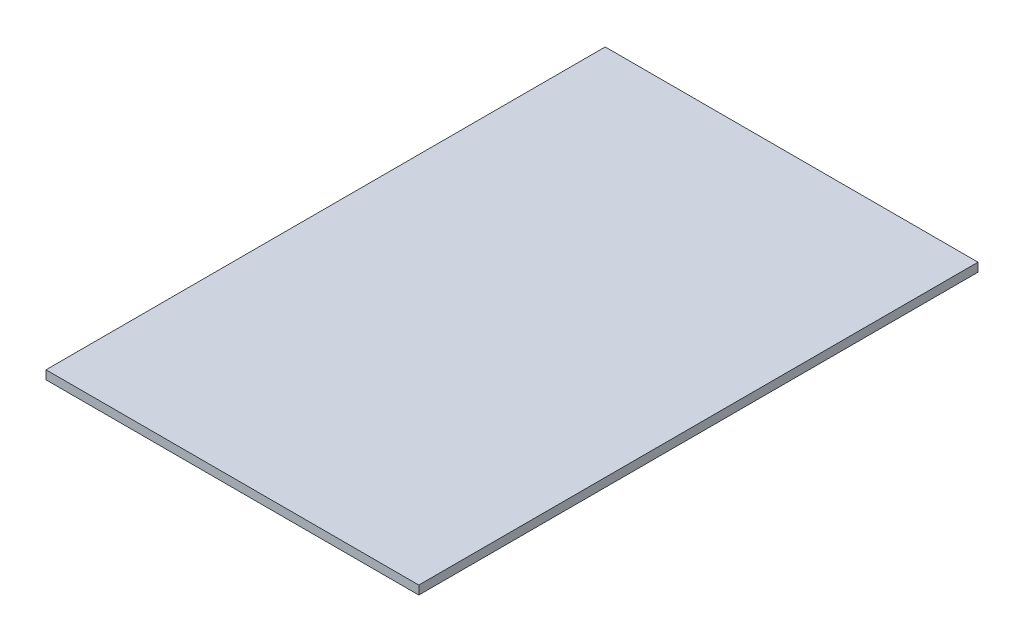
from build123d import *

# Parameters (mm, degrees)
SKETCH1_W           = 600
SKETCH1_H           = 900
BOSS_EXTRUDE1_DEPTH = 14


with BuildPart() as part:
    # Sketch1 → Boss-Extrude1 (new body)
    with BuildSketch(Plane(origin=(0, 0, 0), x_dir=(1, 0, 0), z_dir=(0, 1, 0))):
        with Locations((300, 450)):
            Rectangle(SKETCH1_W, SKETCH1_H)
    extrude(amount=BOSS_EXTRUDE1_DEPTH)


solid = part.part
